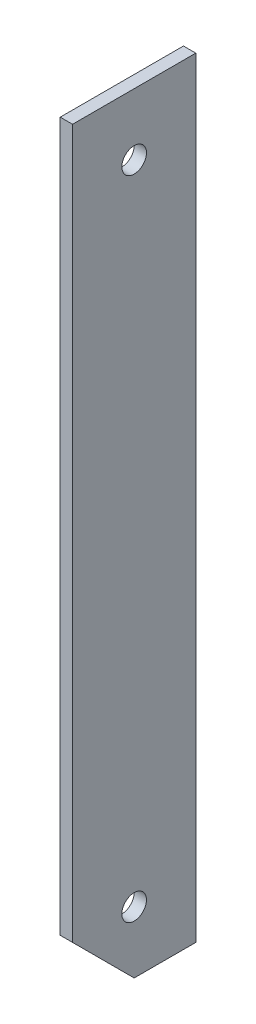
from build123d import *

# Parameters (mm, degrees)
SKETCH1_W           = 40
SKETCH1_H           = 250
SKETCH1_R           = 4
BOSS_EXTRUDE1_DEPTH = 4
CHAMFER3_SIZE       = 20


with BuildPart() as part:
    # Sketch1 → Boss-Extrude1 (new body)
    with BuildSketch(Plane(origin=(0, 0, 0), x_dir=(0, 0, -1), z_dir=(1, 0, 0))):
        Rectangle(SKETCH1_W, SKETCH1_H)
        with Locations((0, 105)):
            Circle(SKETCH1_R, mode=Mode.SUBTRACT)
        with Locations((0, -105)):
            Circle(SKETCH1_R, mode=Mode.SUBTRACT)
    extrude(amount=BOSS_EXTRUDE1_DEPTH)

    # Chamfer3
    chamfer3_edges = [part.edges().sort_by_distance(p)[0] for p in [
        (2, -125, 20),
    ]]
    chamfer(chamfer3_edges, length=CHAMFER3_SIZE)


solid = part.part
